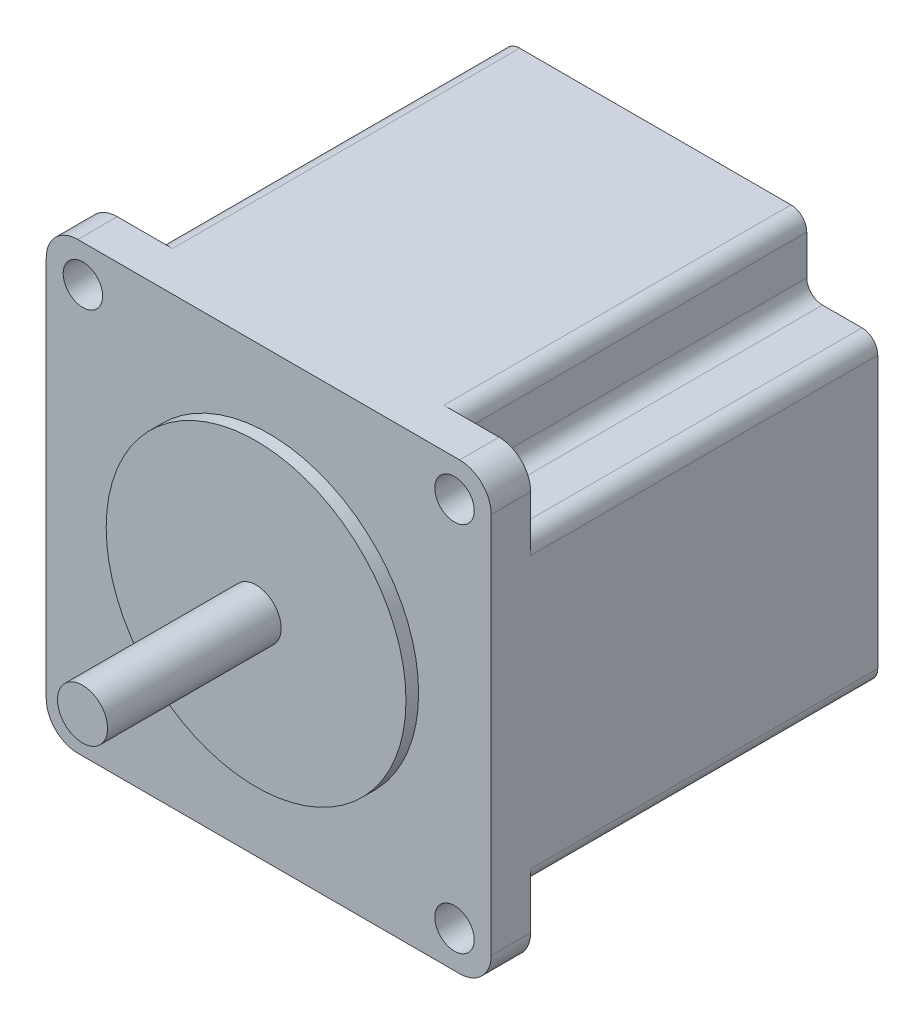
from build123d import *

# Parameters (mm, degrees)
CROQUIS1_W              = 56.4
CROQUIS1_H              = 56.4
SALIENTE_EXTRUIR1_DEPTH = 49
CROQUIS2_R              = 19
SALIENTE_EXTRUIR2_DEPTH = 1.6
CROQUIS3_R              = 3.175
SALIENTE_EXTRUIR3_DEPTH = 22
CROQUIS4_R              = 2.5
CORTAR_EXTRUIR1_DEPTH   = 64.178160784
CROQUIS5_W              = 9
CROQUIS5_H              = 9
CORTAR_EXTRUIR2_DEPTH   = 44
REDONDEO1_R             = 4
REDONDEO2_R             = 2


with BuildPart() as part:
    # Croquis1 → Saliente-Extruir1 (new body)
    with BuildSketch(Plane.XY):
        Rectangle(CROQUIS1_W, CROQUIS1_H)
    extrude(amount=SALIENTE_EXTRUIR1_DEPTH)

    # Croquis2 → Saliente-Extruir2 (add)
    with BuildSketch(Plane.XY.offset(49)):
        Circle(CROQUIS2_R)
    extrude(amount=SALIENTE_EXTRUIR2_DEPTH)

    # Croquis3 → Saliente-Extruir3 (add)
    with BuildSketch(Plane.XY.offset(50.6)):
        Circle(CROQUIS3_R)
    extrude(amount=SALIENTE_EXTRUIR3_DEPTH)

    # Croquis4 → Cortar-Extruir1 (cut, through all)
    with BuildSketch(Plane.XY.offset(49)):
        with Locations((23.55, 23.55)):
            Circle(CROQUIS4_R)
        with Locations((-23.55, 23.55)):
            Circle(CROQUIS4_R)
        with Locations((-23.55, -23.55)):
            Circle(CROQUIS4_R)
        with Locations((23.55, -23.55)):
            Circle(CROQUIS4_R)
    extrude(amount=-CORTAR_EXTRUIR1_DEPTH, mode=Mode.SUBTRACT)

    # Croquis5 → Cortar-Extruir2 (cut)
    with BuildSketch(Plane(origin=(0, 0, 0), x_dir=(-1, 0, 0), z_dir=(0, 0, -1))):
        with Locations((-23.7, 23.7)):
            Rectangle(CROQUIS5_W, CROQUIS5_H)
        with Locations((23.7, 23.7)):
            Rectangle(CROQUIS5_W, CROQUIS5_H)
        with Locations((23.7, -23.7)):
            Rectangle(CROQUIS5_W, CROQUIS5_H)
        with Locations((-23.7, -23.7)):
            Rectangle(CROQUIS5_W, CROQUIS5_H)
    extrude(amount=-CORTAR_EXTRUIR2_DEPTH, mode=Mode.SUBTRACT)

    # Redondeo1
    redondeo1_edges = [part.edges().sort_by_distance(p)[0] for p in [
        (28.2, -28.2, 46.5),
        (-28.2, -28.2, 46.5),
        (-28.2, 28.2, 46.5),
        (28.2, 28.2, 46.5),
    ]]
    fillet(redondeo1_edges, radius=REDONDEO1_R)

    # Redondeo2
    redondeo2_edges = [part.edges().sort_by_distance(p)[0] for p in [
        (28.2, 19.2, 22),
        (19.2, 28.2, 22),
        (19.2, 19.2, 22),
        (-28.2, 19.2, 22),
        (-19.2, 19.2, 22),
        (-19.2, 28.2, 22),
        (-28.2, -19.2, 22),
        (-19.2, -28.2, 22),
        (-19.2, -19.2, 22),
        (28.2, -19.2, 22),
        (19.2, -19.2, 22),
        (19.2, -28.2, 22),
    ]]
    fillet(redondeo2_edges, radius=REDONDEO2_R)


solid = part.part
